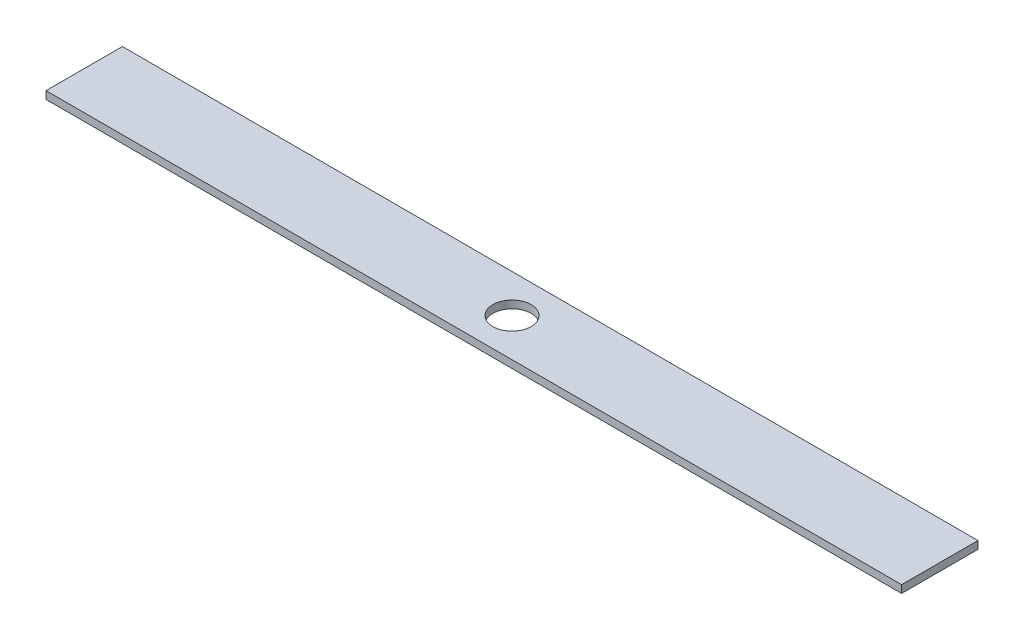
from build123d import *

# Parameters (mm, degrees)
SKETCH1_W           = 355.6
SKETCH1_H           = 31.75
SKETCH1_R           = 7.9375
BOSS_EXTRUDE1_DEPTH = 3.175


with BuildPart() as part:
    # Sketch1 → Boss-Extrude1 (new body)
    with BuildSketch(Plane(origin=(0, 0, 0), x_dir=(1, 0, 0), z_dir=(0, 1, 0))):
        Rectangle(SKETCH1_W, SKETCH1_H)
        with Locations(Location((0, 0, 0), (0, 0, 270))):
            Circle(SKETCH1_R, mode=Mode.SUBTRACT)
    extrude(amount=BOSS_EXTRUDE1_DEPTH)


solid = part.part
